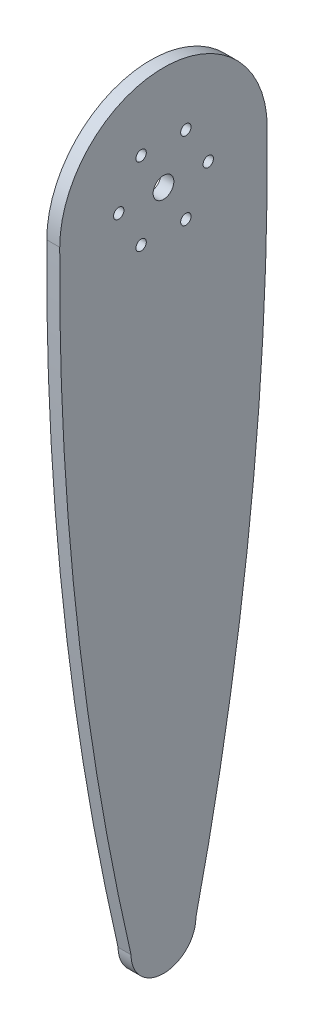
from build123d import *

# Parameters (mm, degrees)
EXTRUDE_1_DEPTH     = 5
SKETCH_2_R          = 2
SKETCH_2_R_2        = 4
CUT_EXTRUDE_1_DEPTH = 293.792434527


with BuildPart() as part:
    # 草图1 → 凸台-拉伸1 (new body)
    with BuildSketch(Plane(origin=(0, 0, 0), x_dir=(0, 0, -1), z_dir=(1, 0, 0))):
        with BuildLine():
            ThreePointArc((-12.5, 0), (0, -12.5), (12.5, 0))
            ThreePointArc((12.5, 0), (33.57319831, 124.194448186), (40, 250))
            ThreePointArc((40, 250), (0, 290), (-40, 250))
            ThreePointArc((-40, 250), (-33.57319831, 124.194448186), (-12.5, 0))
        make_face()
    extrude(amount=EXTRUDE_1_DEPTH)

    # 草图2 → 切除-拉伸1 (cut, through all)
    with BuildSketch(Plane.ZY):
        with Locations((17.25, 250)):
            Circle(SKETCH_2_R)
        with Locations((8.625, 235.061061785)):
            Circle(SKETCH_2_R)
        with Locations((-8.625, 235.061061785)):
            Circle(SKETCH_2_R)
        with Locations((-17.25, 250)):
            Circle(SKETCH_2_R)
        with Locations((-8.625, 264.938938215)):
            Circle(SKETCH_2_R)
        with Locations((8.625, 264.938938215)):
            Circle(SKETCH_2_R)
        with Locations((0, 250)):
            Circle(SKETCH_2_R_2)
    extrude(amount=-CUT_EXTRUDE_1_DEPTH, mode=Mode.SUBTRACT)


solid = part.part
